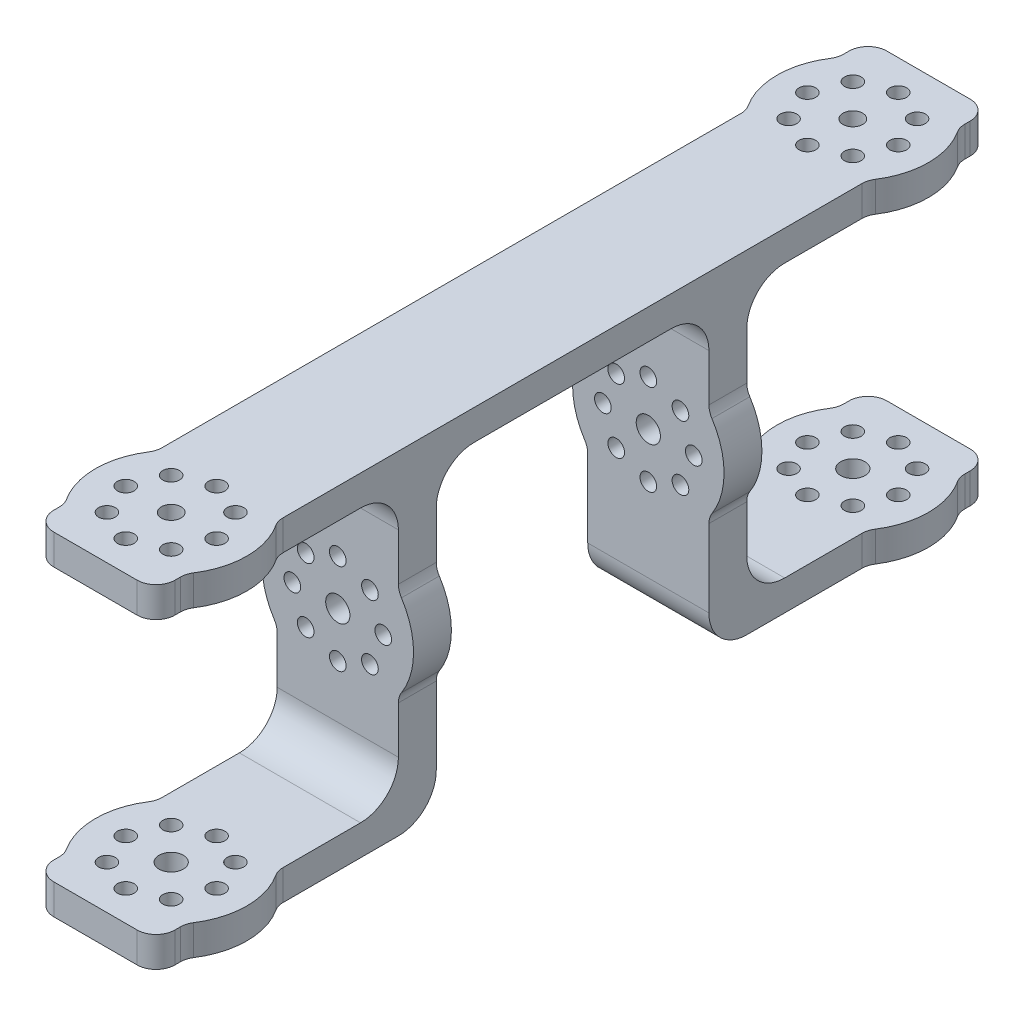
from build123d import *

# Parameters (mm, degrees)
SKETCH_1_R      = 1.6
SKETCH_1_R_2    = 1.1
EXTRUDE_1_DEPTH = 5
SKETCH_2_R      = 1.6
SKETCH_2_R_2    = 1.1
EXTRUDE_2_DEPTH = 4
EXTRUDE_START   = 4
SKETCH_3_R      = 1.1
SKETCH_3_R_2    = 1.3
EXTRUDE_3_DEPTH = 4
FILLET_2_R      = 2.5
SKETCH_4_W      = 16
SKETCH_4_H      = 46
EXTRUDE_4_DEPTH = 4
FILLET_3_R      = 5


with BuildPart() as part:
    # ｽｹｯﾁ1 → ﾎﾞｽ - 押し出し1 (new body)
    with BuildSketch(Plane.XY):
        with BuildLine():
            Line((-8, 0), (8, 0))
            Line((8, 0), (8, 12))
            ThreePointArc((8, 12), (10, 18), (8, 24))
            Line((8, 24), (8, 36))
            Line((8, 36), (-8, 36))
            Line((-8, 36), (-8, 24))
            ThreePointArc((-8, 24), (-10, 18), (-8, 12))
            Line((-8, 12), (-8, 0))
        make_face()
        with Locations((0, 18)):
            Circle(SKETCH_1_R, mode=Mode.SUBTRACT)
        with Locations((0, 24)):
            Circle(SKETCH_1_R_2, mode=Mode.SUBTRACT)
        with Locations((4.242640687, 22.242640687)):
            Circle(SKETCH_1_R_2, mode=Mode.SUBTRACT)
        with Locations((6, 18)):
            Circle(SKETCH_1_R_2, mode=Mode.SUBTRACT)
        with Locations((4.242640687, 13.757359313)):
            Circle(SKETCH_1_R_2, mode=Mode.SUBTRACT)
        with Locations((0, 12)):
            Circle(SKETCH_1_R_2, mode=Mode.SUBTRACT)
        with Locations((-4.242640687, 13.757359313)):
            Circle(SKETCH_1_R_2, mode=Mode.SUBTRACT)
        with Locations((-6, 18)):
            Circle(SKETCH_1_R_2, mode=Mode.SUBTRACT)
        with Locations((-4.242640687, 22.242640687)):
            Circle(SKETCH_1_R_2, mode=Mode.SUBTRACT)
    extrude(amount=EXTRUDE_1_DEPTH)

    # ｽｹｯﾁ2 → ﾎﾞｽ - 押し出し2 (add)
    with BuildSketch(Plane.XZ):
        with BuildLine():
            Line((-8, 0), (8, 0))
            Line((8, 0), (8, 21))
            ThreePointArc((8, 21), (10, 27), (8, 33))
            Line((8, 33), (8, 37))
            Line((8, 37), (-8, 37))
            Line((-8, 37), (-8, 33))
            ThreePointArc((-8, 33), (-10, 27), (-8, 21))
            Line((-8, 21), (-8, 0))
        make_face()
        with Locations(Location((0, 27, 0), (0, 0, 270))):
            Circle(SKETCH_2_R, mode=Mode.SUBTRACT)
        with Locations(Location((6, 27, 0), (0, 0, 270))):
            Circle(SKETCH_2_R_2, mode=Mode.SUBTRACT)
        with Locations(Location((4.242640687, 22.757359313, 0), (0, 0, 270))):
            Circle(SKETCH_2_R_2, mode=Mode.SUBTRACT)
        with Locations(Location((0, 21, 0), (0, 0, 270))):
            Circle(SKETCH_2_R_2, mode=Mode.SUBTRACT)
        with Locations(Location((-4.242640687, 22.757359313, 0), (0, 0, 270))):
            Circle(SKETCH_2_R_2, mode=Mode.SUBTRACT)
        with Locations(Location((-6, 27, 0), (0, 0, 270))):
            Circle(SKETCH_2_R_2, mode=Mode.SUBTRACT)
        with Locations(Location((-4.242640687, 31.242640687, 0), (0, 0, 270))):
            Circle(SKETCH_2_R_2, mode=Mode.SUBTRACT)
        with Locations(Location((0, 33, 0), (0, 0, 270))):
            Circle(SKETCH_2_R_2, mode=Mode.SUBTRACT)
        with Locations(Location((4.242640687, 31.242640687, 0), (0, 0, 270))):
            Circle(SKETCH_2_R_2, mode=Mode.SUBTRACT)
    extrude(amount=EXTRUDE_2_DEPTH)

    # ｽｹｯﾁ3 → ﾎﾞｽ - 押し出し3 (add)
    with BuildSketch(Plane(origin=(0, 36, 0), x_dir=(1, 0, 0), z_dir=(0, 1, 0)).offset(EXTRUDE_START)):
        with BuildLine():
            Line((8, -5), (8, 0))
            Line((8, 0), (-8, 0))
            Line((-8, 0), (-8, -5))
            Line((-8, -5), (-8, -21))
            ThreePointArc((-8, -21), (-10, -27), (-8, -33))
            Line((-8, -33), (-8, -37))
            Line((-8, -37), (8, -37))
            Line((8, -37), (8, -33))
            ThreePointArc((8, -33), (10, -27), (8, -21))
            Line((8, -21), (8, -5))
        make_face()
        with Locations(Location((4.242640687, -22.757359313, 0), (0, 0, 90))):
            Circle(SKETCH_3_R, mode=Mode.SUBTRACT)
        with Locations(Location((0, -21, 0), (0, 0, 90))):
            Circle(SKETCH_3_R, mode=Mode.SUBTRACT)
        with Locations(Location((-4.242640687, -22.757359313, 0), (0, 0, 90))):
            Circle(SKETCH_3_R, mode=Mode.SUBTRACT)
        with Locations(Location((-6, -27, 0), (0, 0, 90))):
            Circle(SKETCH_3_R, mode=Mode.SUBTRACT)
        with Locations(Location((-4.242640687, -31.242640687, 0), (0, 0, 90))):
            Circle(SKETCH_3_R, mode=Mode.SUBTRACT)
        with Locations(Location((0, -33, 0), (0, 0, 90))):
            Circle(SKETCH_3_R, mode=Mode.SUBTRACT)
        with Locations(Location((4.242640687, -31.242640687, 0), (0, 0, 90))):
            Circle(SKETCH_3_R, mode=Mode.SUBTRACT)
        with Locations(Location((6, -27, 0), (0, 0, 90))):
            Circle(SKETCH_3_R, mode=Mode.SUBTRACT)
        with Locations(Location((0, -27, 0), (0, 0, 270))):
            Circle(SKETCH_3_R_2, mode=Mode.SUBTRACT)
    extrude(amount=-EXTRUDE_3_DEPTH)

    # ﾌｨﾚｯﾄ2
    fillet_2_edges = [part.edges().sort_by_distance(p)[0] for p in [
        (8, 38, 21),
        (-8, 38, 21),
        (-8, 38, 33),
        (-8, 38, 37),
        (8, 38, 37),
        (8, 38, 33),
        (-8, 12, 2.5),
        (-8, 24, 2.5),
        (8, 24, 2.5),
        (8, 12, 2.5),
        (-8, -2, 21),
        (8, -2, 21),
        (8, -2, 33),
        (8, -2, 37),
        (-8, -2, 37),
        (-8, -2, 33),
    ]]
    fillet(fillet_2_edges, radius=FILLET_2_R)


with BuildPart() as body_2:
    # ﾐﾗｰ2: mirrored copy
    add(part.part.mirror(Plane.XY.offset(-18)))


with BuildPart() as part_1:
    add(part.part)

    add(body_2.part)  # ﾎﾞｽ - 押し出し4 merges body 2
    # ｽｹｯﾁ4 → ﾎﾞｽ - 押し出し4 (add)
    with BuildSketch(Plane(origin=(0, 40, 0), x_dir=(1, 0, 0), z_dir=(0, 1, 0))):
        with Locations((0, 18)):
            Rectangle(SKETCH_4_W, SKETCH_4_H)
    extrude(amount=-EXTRUDE_4_DEPTH)

    # ﾌｨﾚｯﾄ3
    fillet_3_edges = [part_1.edges().sort_by_distance(p)[0] for p in [
        (0, 36, 5),
        (0, 36, 0),
        (0, 36, -36),
        (0, -4, -36),
        (0, 0, -41),
        (0, 36, -41),
        (0, -4, 0),
        (0, 0, 5),
    ]]
    fillet(fillet_3_edges, radius=FILLET_3_R)


solid = part_1.part
